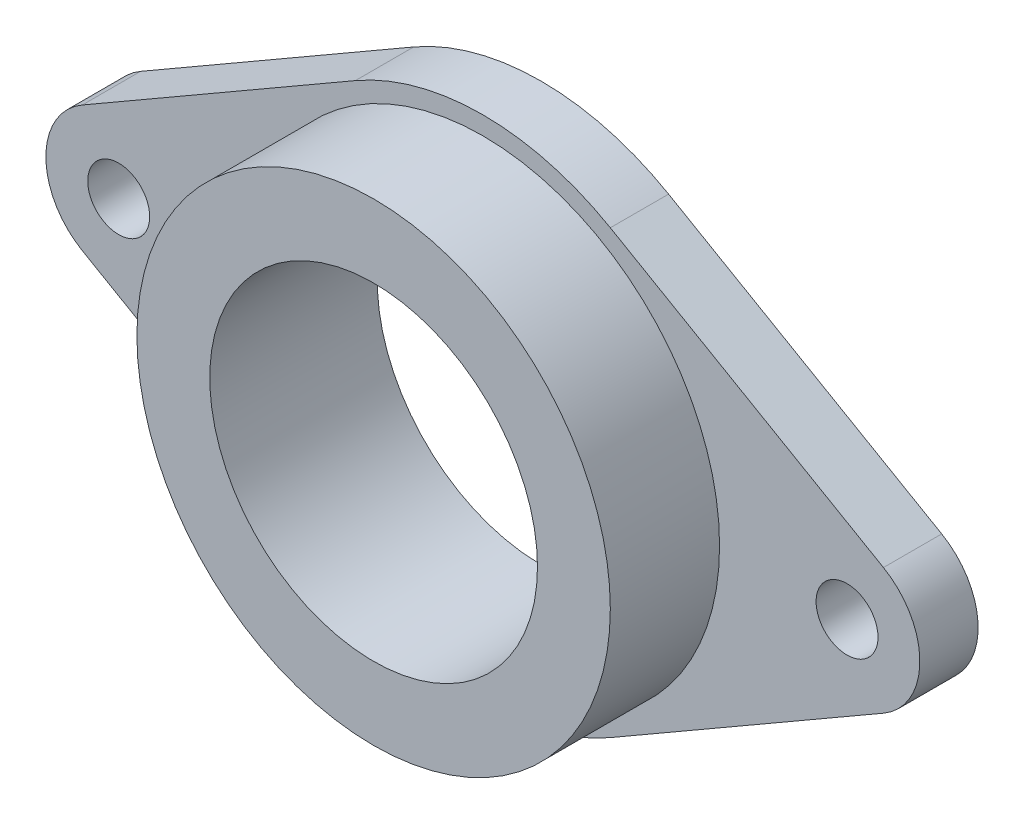
from build123d import *

# Parameters (mm, degrees)
SKETCH1_R           = 4.25
BOSS_EXTRUDE1_DEPTH = 8
SKETCH2_R           = 32.5
BOSS_EXTRUDE2_DEPTH = 15
SKETCH3_R           = 22.5
CUT_EXTRUDE1_DEPTH  = 74.17103252


with BuildPart() as part:
    # Sketch1 → Boss-Extrude1 (new body)
    with BuildSketch(Plane.XY):
        with BuildLine():
            Line((-55, 8.660254038), (-17.5, 30.310889132))
            ThreePointArc((-17.5, 30.310889132), (0, 35), (17.5, 30.310889132))
            Line((17.5, 30.310889132), (55, 8.660254038))
            ThreePointArc((55, 8.660254038), (60, 0), (55, -8.660254038))
            Line((55, -8.660254038), (17.5, -30.310889132))
            ThreePointArc((17.5, -30.310889132), (0, -35), (-17.5, -30.310889132))
            Line((-17.5, -30.310889132), (-55, -8.660254038))
            ThreePointArc((-55, -8.660254038), (-60, 0), (-55, 8.660254038))
        make_face()
        with Locations((-50, 0)):
            Circle(SKETCH1_R, mode=Mode.SUBTRACT)
        with Locations((50, 0)):
            Circle(SKETCH1_R, mode=Mode.SUBTRACT)
    extrude(amount=BOSS_EXTRUDE1_DEPTH)

    # Sketch2 → Boss-Extrude2 (add)
    with BuildSketch(Plane.XY.offset(8)):
        Circle(SKETCH2_R)
    extrude(amount=BOSS_EXTRUDE2_DEPTH)

    # Sketch3 → Cut-Extrude1 (cut, through all)
    with BuildSketch(Plane.XY.offset(23)):
        Circle(SKETCH3_R)
    extrude(amount=-CUT_EXTRUDE1_DEPTH, mode=Mode.SUBTRACT)


solid = part.part
